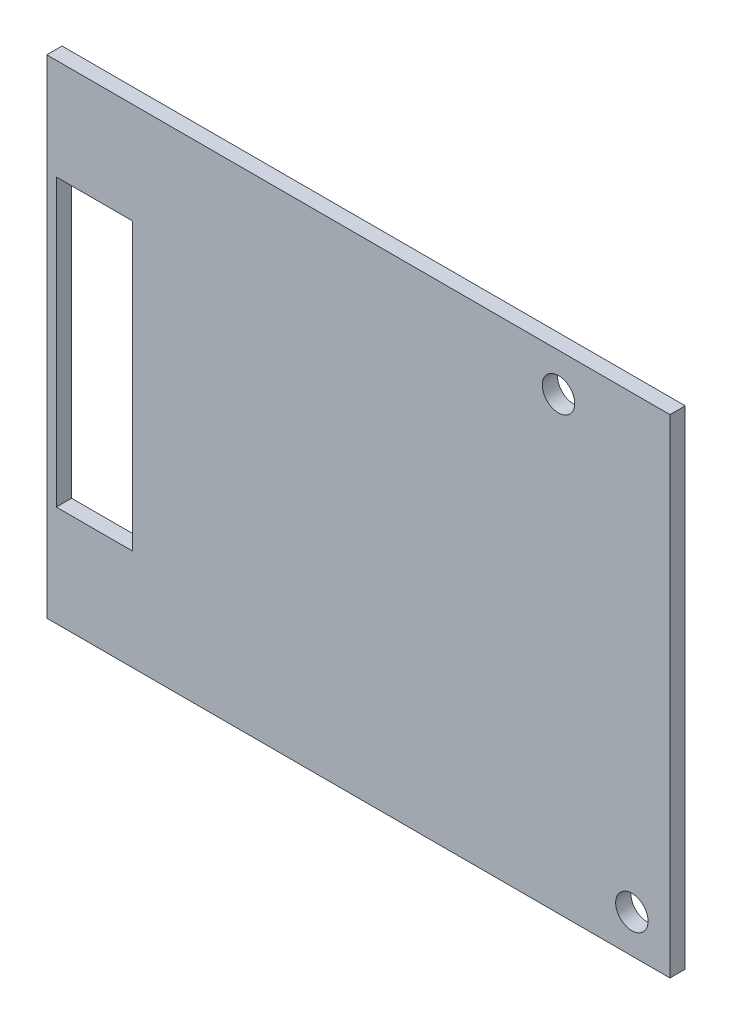
from build123d import *

# Parameters (mm, degrees)
SKETCH1_W           = 65.4
SKETCH1_H           = 51.2
SKETCH1_R           = 1.7
SKETCH1_W_2         = 8
SKETCH1_H_2         = 30
BOSS_EXTRUDE1_DEPTH = 1.6


with BuildPart() as part:
    # Sketch1 → Boss-Extrude1 (new body)
    with BuildSketch(Plane.XY):
        with Locations((32.7, 25.6)):
            Rectangle(SKETCH1_W, SKETCH1_H)
        with Locations((61.4, 4)):
            Circle(SKETCH1_R, mode=Mode.SUBTRACT)
        with Locations((53.7, 47.2)):
            Circle(SKETCH1_R, mode=Mode.SUBTRACT)
        with Locations((5, 25.6)):
            Rectangle(SKETCH1_W_2, SKETCH1_H_2, mode=Mode.SUBTRACT)
    extrude(amount=BOSS_EXTRUDE1_DEPTH)


solid = part.part
